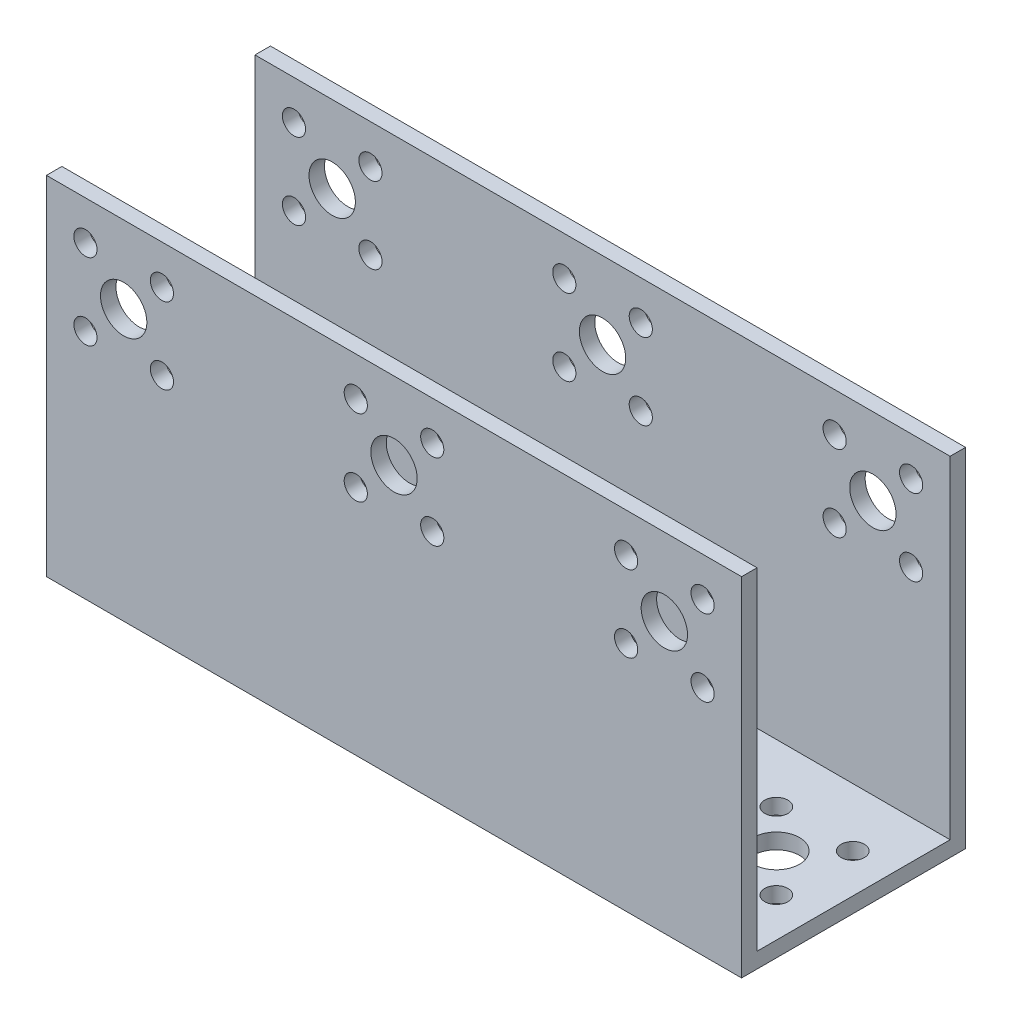
from build123d import *

# Parameters (mm, degrees)
SKETCH_1_W          = 90
SKETCH_1_H          = 29
EXTRUDE_1_DEPTH     = 2
SKETCH_4_R          = 3
SKETCH_4_R_2        = 1.5
CUT_EXTRUDE_1_DEPTH = 2
SKETCH_2_W          = 90
SKETCH_2_H          = 2
EXTRUDE_2_DEPTH     = 43
SKETCH_5_R          = 3
SKETCH_5_R_2        = 1.5
CUT_EXTRUDE_2_DEPTH = 2


with BuildPart() as part:
    # 草图1 → 凸台-拉伸1 (new body)
    with BuildSketch(Plane(origin=(0, 0, 0), x_dir=(1, 0, 0), z_dir=(0, 1, 0))):
        with Locations((45, 14.5)):
            Rectangle(SKETCH_1_W, SKETCH_1_H)
    extrude(amount=EXTRUDE_1_DEPTH)

    # 草图4 → 切除-拉伸1 (cut)
    with BuildSketch(Plane(origin=(0, 2, 0), x_dir=(1, 0, 0), z_dir=(0, 1, 0))):
        with Locations(Location((45, 14.5, 0), (0, 0, 270))):
            Circle(SKETCH_4_R)
        with Locations(Location((49.950012223, 20.223506144, 0), (0, 0, 270))):
            Circle(SKETCH_4_R_2)
        with Locations(Location((49.949507065, 10.323986856, 0), (0, 0, 270))):
            Circle(SKETCH_4_R_2)
        with Locations(Location((40.049987777, 10.324492014, 0), (0, 0, 270))):
            Circle(SKETCH_4_R_2)
        with Locations(Location((40.050492935, 20.224011302, 0), (0, 0, 270))):
            Circle(SKETCH_4_R_2)
        with Locations(Location((80, 14.5, 0), (0, 0, 270))):
            Circle(SKETCH_4_R)
        with Locations(Location((84.950012223, 19.449507065, 0), (0, 0, 270))):
            Circle(SKETCH_4_R_2)
        with Locations(Location((75.050492935, 19.450012223, 0), (0, 0, 270))):
            Circle(SKETCH_4_R_2)
        with Locations(Location((75.049987777, 9.550492935, 0), (0, 0, 270))):
            Circle(SKETCH_4_R_2)
        with Locations(Location((84.949507065, 9.549987777, 0), (0, 0, 270))):
            Circle(SKETCH_4_R_2)
        with Locations(Location((5.050492935, 9.549987777, 0), (0, 0, 90))):
            Circle(SKETCH_4_R_2)
        with Locations(Location((14.950012223, 9.550492935, 0), (0, 0, 90))):
            Circle(SKETCH_4_R_2)
        with Locations(Location((5.049987777, 19.449507065, 0), (0, 0, 90))):
            Circle(SKETCH_4_R_2)
        with Locations(Location((10, 14.5, 0), (0, 0, 90))):
            Circle(SKETCH_4_R)
        with Locations(Location((14.949507065, 19.450012223, 0), (0, 0, 90))):
            Circle(SKETCH_4_R_2)
    extrude(amount=-CUT_EXTRUDE_1_DEPTH, mode=Mode.SUBTRACT)

    # 草图2 → 凸台-拉伸2 (add)
    with BuildSketch(Plane(origin=(0, 2, 0), x_dir=(1, 0, 0), z_dir=(0, 1, 0))):
        with Locations((45, 28)):
            Rectangle(SKETCH_2_W, SKETCH_2_H)
    extrude_2 = extrude(amount=EXTRUDE_2_DEPTH)

    # 草图5 → 切除-拉伸2 (cut)
    with BuildSketch(Plane.XY.offset(-27)):
        with Locations((45, 35)):
            Circle(SKETCH_5_R)
        with Locations((49.950012223, 39.949507065)):
            Circle(SKETCH_5_R_2)
        with Locations((49.949507065, 30.049987777)):
            Circle(SKETCH_5_R_2)
        with Locations((40.049987777, 30.050492935)):
            Circle(SKETCH_5_R_2)
        with Locations((40.050492935, 39.950012223)):
            Circle(SKETCH_5_R_2)
        with Locations((80, 35)):
            Circle(SKETCH_5_R)
        with Locations((84.950012223, 39.949507065)):
            Circle(SKETCH_5_R_2)
        with Locations((75.050492935, 39.950012223)):
            Circle(SKETCH_5_R_2)
        with Locations((75.049987777, 30.050492935)):
            Circle(SKETCH_5_R_2)
        with Locations((84.949507065, 30.049987777)):
            Circle(SKETCH_5_R_2)
        with Locations(Location((5.050492935, 30.049987777, 0), (0, 0, 180))):
            Circle(SKETCH_5_R_2)
        with Locations(Location((14.950012223, 30.050492935, 0), (0, 0, 180))):
            Circle(SKETCH_5_R_2)
        with Locations(Location((5.049987777, 39.949507065, 0), (0, 0, 180))):
            Circle(SKETCH_5_R_2)
        with Locations(Location((10, 35, 0), (0, 0, 180))):
            Circle(SKETCH_5_R)
        with Locations(Location((14.949507065, 39.950012223, 0), (0, 0, 180))):
            Circle(SKETCH_5_R_2)
    cut_extrude_2 = extrude(amount=-CUT_EXTRUDE_2_DEPTH, mode=Mode.SUBTRACT)

    # 镜向1: 凸台-拉伸2, 切除-拉伸2 across plane
    add(extrude_2.mirror(Plane(origin=(0, 0, -14.5), x_dir=(1, 0, 0), z_dir=(0, 0, -1))))
    add(cut_extrude_2.mirror(Plane(origin=(0, 0, -14.5), x_dir=(1, 0, 0), z_dir=(0, 0, -1))), mode=Mode.SUBTRACT)


solid = part.part
